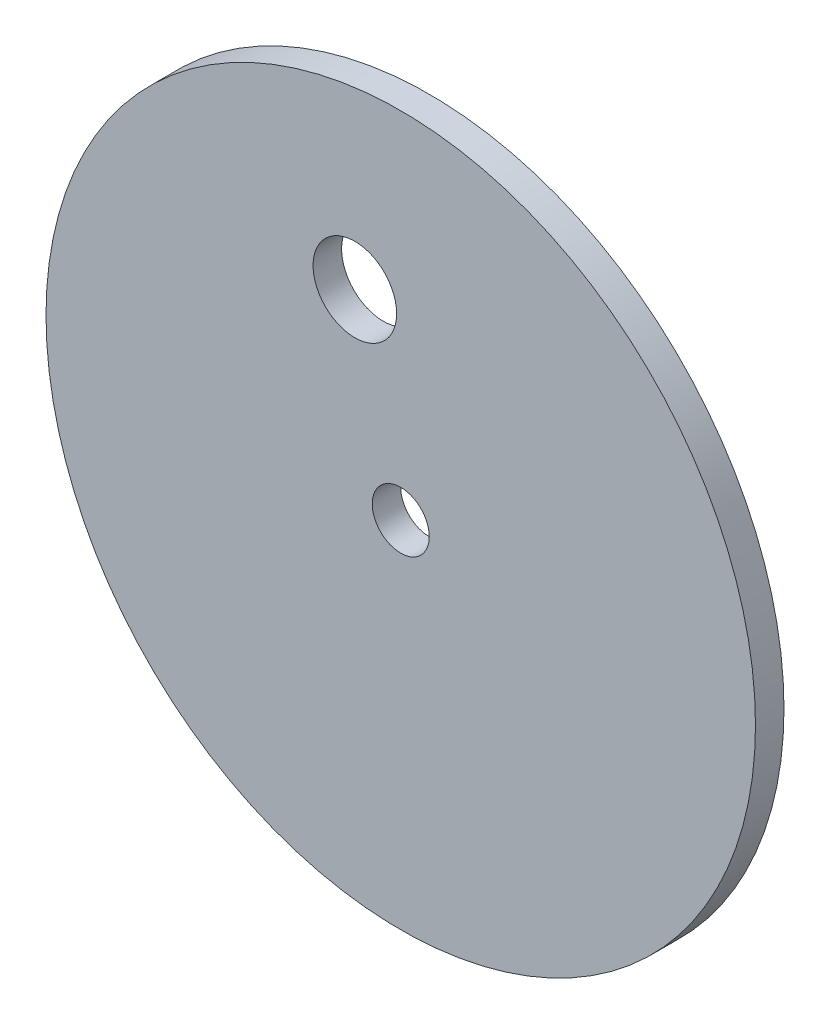
from build123d import *

# Parameters (mm, degrees)
SKETCH_1_R      = 124.4
SKETCH_1_R_2    = 14.649549738
SKETCH_1_R_3    = 10
EXTRUDE_1_DEPTH = 10


with BuildPart() as part:
    # ｽｹｯﾁ1 → ﾎﾞｽ - 押し出し1 (new body)
    with BuildSketch(Plane.XY):
        Circle(SKETCH_1_R)
        with Locations((-16.093350468, 62.016427225)):
            Circle(SKETCH_1_R_2, mode=Mode.SUBTRACT)
        Circle(SKETCH_1_R_3, mode=Mode.SUBTRACT)
    extrude(amount=EXTRUDE_1_DEPTH)


solid = part.part
